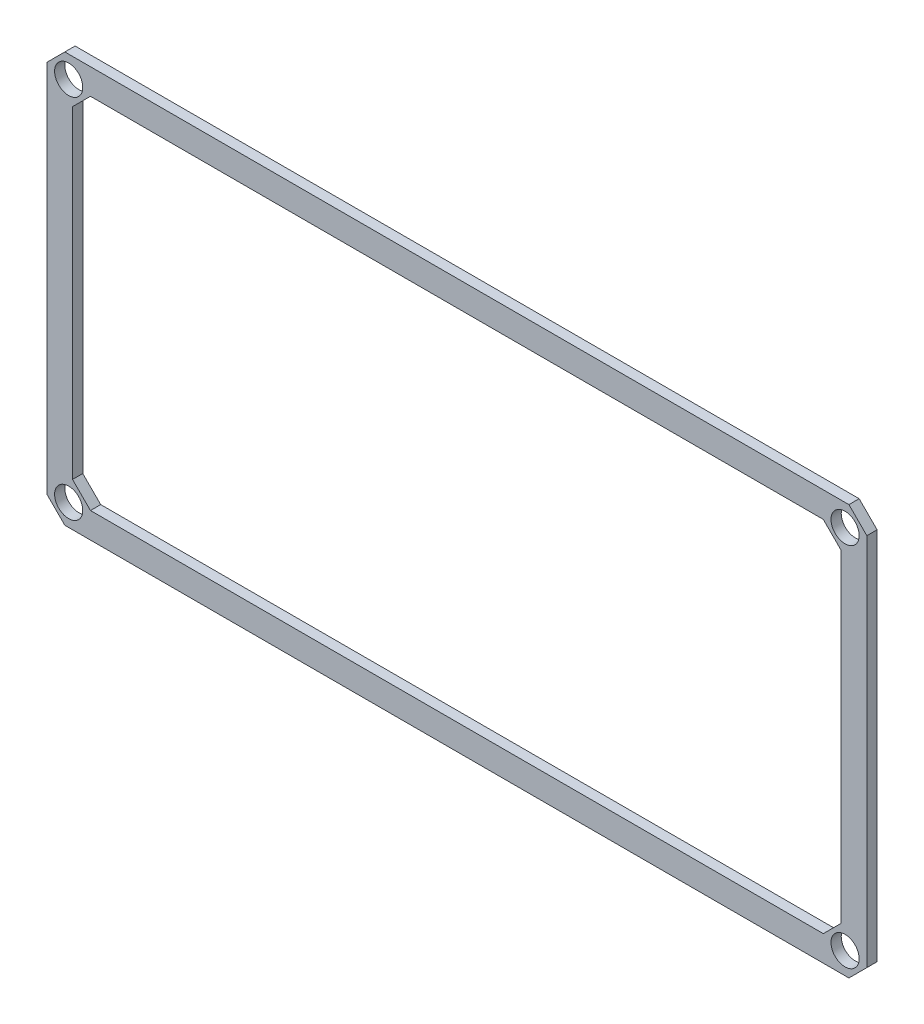
from build123d import *

# Parameters (mm, degrees)
SKETCH1_W            = 160
SKETCH1_H            = 80
SKETCH1_W_2          = 150
SKETCH1_H_2          = 70
BOSS_EXTRUDE1_DEPTH  = 2
CHAMFER1_SIZE        = 3.5
M5_CLEARANCE_HOLE1_D = 5.5


with BuildPart() as part:
    # Sketch1 → Boss-Extrude1 (new body)
    with BuildSketch(Plane.XY):
        Rectangle(SKETCH1_W, SKETCH1_H)
        Rectangle(SKETCH1_W_2, SKETCH1_H_2, mode=Mode.SUBTRACT)
    extrude(amount=BOSS_EXTRUDE1_DEPTH)

    # Chamfer1
    chamfer1_edges = [part.edges().sort_by_distance(p)[0] for p in [
        (-75, 35, 1),
        (-75, -35, 1),
        (75, -35, 1),
        (75, 35, 1),
        (80, -40, 1),
        (-80, -40, 1),
        (-80, 40, 1),
        (80, 40, 1),
    ]]
    chamfer(chamfer1_edges, length=CHAMFER1_SIZE)

    # M5 Clearance Hole1 (through all)
    with Locations(Plane(origin=(0, 0, 0), x_dir=(-1, 0, 0), z_dir=(0, 0, -1))):
        with Locations((0, 0), (-75.75, 35.75), (75.75, -35.75), (75.75, 35.75), (-75.75, -35.75)):
            Hole(M5_CLEARANCE_HOLE1_D / 2)


solid = part.part
